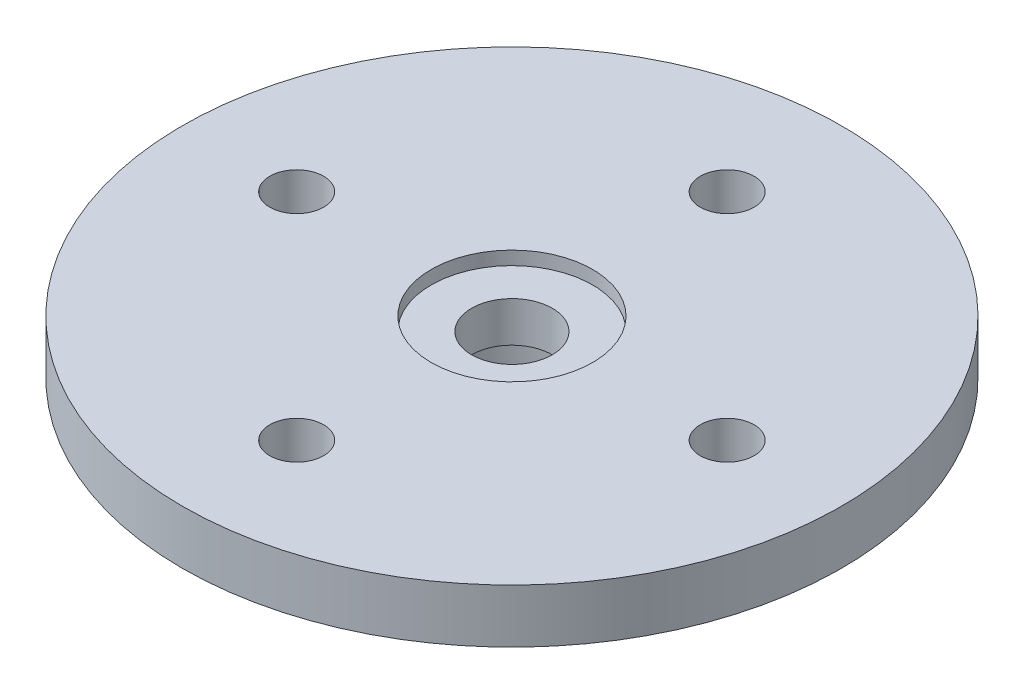
from build123d import *

# Parameters (mm, degrees)
SKETCH_1_R          = 12.25
SKETCH_1_R_2        = 3
SKETCH_1_R_3        = 1
SKETCH_1_R_4        = 2.9
SKETCH_1_R_5        = 1.5
EXTRUDE_1_DEPTH     = 2
SKETCH_2_R          = 4.9
SKETCH_2_R_2        = 2.9
EXTRUDE_2_DEPTH     = 3
CUT_EXTRUDE_START   = 2
SKETCH_1_4_R        = 3
CUT_EXTRUDE_1_DEPTH = 0.5


with BuildPart() as part:
    # 草图1 → 凸台-拉伸1 (new body)
    # profile 1 of 3: a face of its own
    with BuildSketch(Plane(origin=(0, 0, 0), x_dir=(1, 0, 0), z_dir=(0, 1, 0))):
        with Locations(Location((0, 0, 0), (0, 0, 270))):
            Circle(SKETCH_1_R)
        Circle(SKETCH_1_R_2, mode=Mode.SUBTRACT)
        with Locations(Location((-8, 0, 0), (0, 0, 270))):
            Circle(SKETCH_1_R_3, mode=Mode.SUBTRACT)
        with Locations(Location((0, -8, 0), (0, 0, 270))):
            Circle(SKETCH_1_R_3, mode=Mode.SUBTRACT)
        with Locations(Location((8, 0, 0), (0, 0, 270))):
            Circle(SKETCH_1_R_3, mode=Mode.SUBTRACT)
        with Locations(Location((0, 8, 0), (0, 0, 270))):
            Circle(SKETCH_1_R_3, mode=Mode.SUBTRACT)
    # profile 2 of 3: a face of its own
    with BuildSketch(Plane(origin=(0, 0, 0), x_dir=(1, 0, 0), z_dir=(0, 1, 0))):
        Circle(SKETCH_1_R_2)
        Circle(SKETCH_1_R_4, mode=Mode.SUBTRACT)
    # profile 3 of 3: a face of its own
    with BuildSketch(Plane(origin=(0, 0, 0), x_dir=(1, 0, 0), z_dir=(0, 1, 0))):
        Circle(SKETCH_1_R_4)
        with Locations(Location((0, 0, 0), (0, 0, 270))):
            Circle(SKETCH_1_R_5, mode=Mode.SUBTRACT)
    extrude(amount=EXTRUDE_1_DEPTH)

    # 草图2 → 凸台-拉伸2 (add)
    with BuildSketch(Plane.XZ):
        with Locations(Location((0, 0, 0), (0, 0, 90))):
            Circle(SKETCH_2_R)
        with Locations(Location((0, 0, 0), (0, 0, 270))):
            Circle(SKETCH_2_R_2, mode=Mode.SUBTRACT)
    extrude(amount=EXTRUDE_2_DEPTH)

    # 草图1<4> → 切除-拉伸1 (cut)
    with BuildSketch(Plane(origin=(0, 0, 0), x_dir=(1, 0, 0), z_dir=(0, 1, 0)).offset(CUT_EXTRUDE_START)):
        with Locations(Location((0, 0, 0), (0, 0, 270))):
            Circle(SKETCH_1_4_R)
    extrude(amount=-CUT_EXTRUDE_1_DEPTH, mode=Mode.SUBTRACT)


solid = part.part
